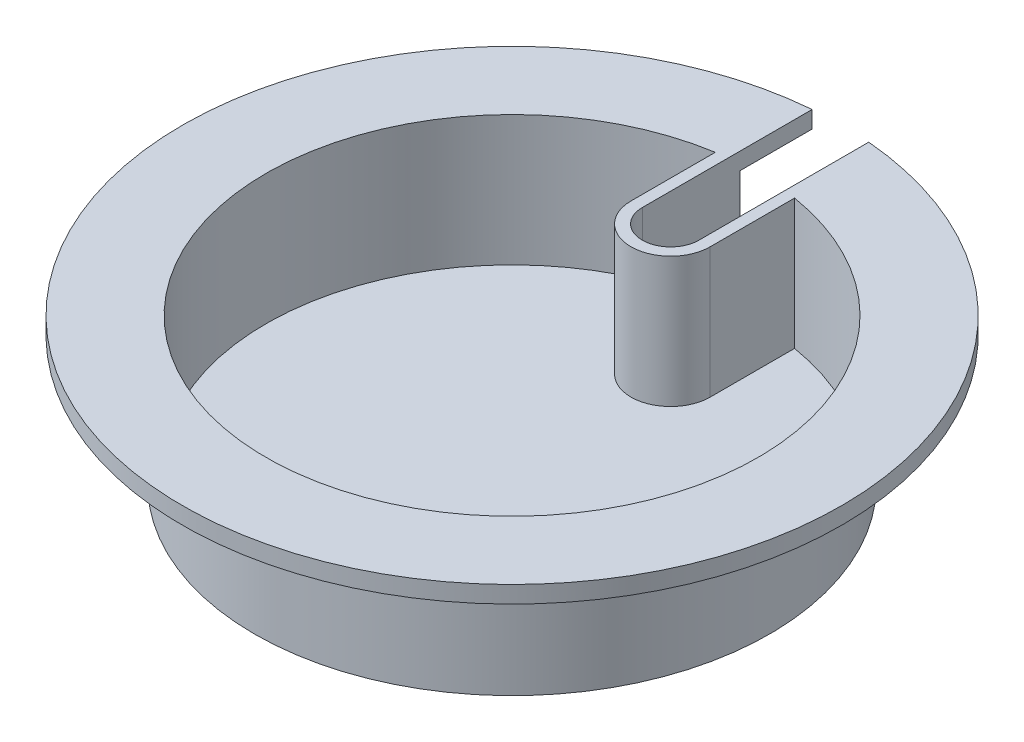
from build123d import *

# Parameters (mm, degrees)
BOSS_EXTRUDE11_DEPTH = 1.5
BOSS_EXTRUDE12_START = 10
BOSS_EXTRUDE12_DEPTH = 10
BOSS_EXTRUDE15_START = 11.5
BOSS_EXTRUDE15_DEPTH = 1.5


with BuildPart() as part:
    # base → Boss-Extrude11 (new body)
    with BuildSketch(Plane(origin=(0, 0, 0), x_dir=(1, 0, 0), z_dir=(0, 1, 0))):
        with BuildLine():
            Line((-2.5, 14), (-2.5, 22.612220148))
            ThreePointArc((-2.5, 22.612220148), (0, -22.75), (2.5, 22.612220148))
            Line((2.5, 22.612220148), (2.5, 14))
            ThreePointArc((2.5, 14), (0, 11.5), (-2.5, 14))
        make_face()
    extrude(amount=-BOSS_EXTRUDE11_DEPTH)

    # rim → Boss-Extrude12 (add)
    with BuildSketch(Plane(origin=(0, 0, 0), x_dir=(1, 0, 0), z_dir=(0, 1, 0)).offset(BOSS_EXTRUDE12_START)):
        with BuildLine():
            Line((2.5, 22.612220148), (2.5, 14))
            ThreePointArc((2.5, 14), (0, 11.5), (-2.5, 14))
            Line((-2.5, 14), (-2.5, 22.612220148))
            ThreePointArc((-2.5, 22.612220148), (0, -22.75), (2.5, 22.612220148))
        make_face()
        with BuildLine():
            Line((-3.5, 21.446457505), (-3.5, 14))
            ThreePointArc((-3.5, 14), (0, 10.5), (3.5, 14))
            Line((3.5, 14), (3.5, 21.446457505))
            ThreePointArc((3.5, 21.446457505), (0, -21.730175782), (-3.5, 21.446457505))
        make_face(mode=Mode.SUBTRACT)
    extrude(amount=-BOSS_EXTRUDE12_DEPTH)

    # lid → Boss-Extrude15 (add)
    with BuildSketch(Plane(origin=(0, 0, 0), x_dir=(1, 0, 0), z_dir=(0, 1, 0)).offset(BOSS_EXTRUDE15_START)):
        with BuildLine():
            Line((-2.5, 14), (-2.5, 29))
            ThreePointArc((-2.5, 29), (0, -29.107559156), (2.5, 29))
            Line((2.5, 29), (2.5, 14))
            ThreePointArc((2.5, 14), (0, 11.5), (-2.5, 14))
        make_face()
        with BuildLine():
            ThreePointArc((-3.5, 21.446457505), (0, -21.730175782), (3.5, 21.446457505))
            Line((3.5, 21.446457505), (3.5, 14))
            ThreePointArc((3.5, 14), (0, 10.5), (-3.5, 14))
            Line((-3.5, 14), (-3.5, 21.446457505))
        make_face(mode=Mode.SUBTRACT)
    extrude(amount=-BOSS_EXTRUDE15_DEPTH)


solid = part.part
